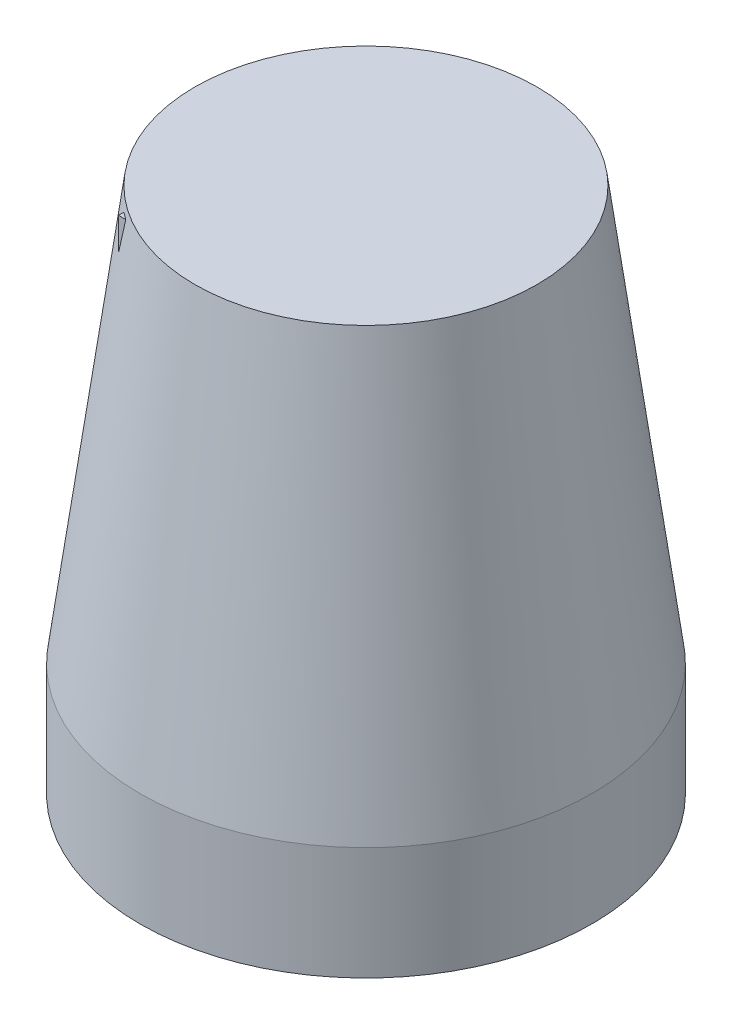
from build123d import *

# Parameters (mm, degrees)
SKETCH1_R           = 5.0038
BOSS_EXTRUDE1_DEPTH = 12.0904
SKETCH1_5_R         = 6.604
SKETCH1_6_R         = 6.604
BOSS_EXTRUDE2_DEPTH = 3.302
SKETCH2_R           = 2.9972
CUT_EXTRUDE1_DEPTH  = 11.43
SKETCH3_R           = 5.2705
CUT_EXTRUDE2_DEPTH  = 2.9464
SKETCH4_W           = 1.623389838
SKETCH4_H           = 6.759688833
BOSS_EXTRUDE3_DEPTH = 12.192


with BuildPart() as part:
    # Sketch1 → Boss-Extrude1 (new body)
    with BuildSketch(Plane(origin=(0, 0, 0), x_dir=(1, 0, 0), z_dir=(0, 1, 0))):
        Circle(SKETCH1_R)
    extrude(amount=BOSS_EXTRUDE1_DEPTH)

    # Sketch1<5> → section 0 of loft1
    with BuildSketch(Plane(origin=(0, 0, 0), x_dir=(1, 0, 0), z_dir=(0, 1, 0)), mode=Mode.PRIVATE) as loft1_s0:
        Circle(SKETCH1_5_R)
    # loft up to a face of the part (loft1)
    loft([loft1_s0.sketch, Face(Wire([part.edges().sort_by_distance((-3.425336809, 12.0904, -3.647613218))[0]]))])

    # Sketch1<6> → Boss-Extrude2 (add)
    with BuildSketch(Plane(origin=(0, 0, 0), x_dir=(1, 0, 0), z_dir=(0, 1, 0))):
        Circle(SKETCH1_6_R)
    extrude(amount=-BOSS_EXTRUDE2_DEPTH)

    # Sketch2 → Cut-Extrude1 (cut)
    with BuildSketch(Plane.XZ.offset(3.302)):
        Circle(SKETCH2_R)
    extrude(amount=-CUT_EXTRUDE1_DEPTH, mode=Mode.SUBTRACT)

    # Sketch3 → Cut-Extrude2 (cut)
    with BuildSketch(Plane.XZ.offset(3.302)):
        Circle(SKETCH3_R)
    extrude(amount=-CUT_EXTRUDE2_DEPTH, mode=Mode.SUBTRACT)

    # Sketch4 → Boss-Extrude3 (add)
    with BuildSketch(Plane.XZ.offset(0.3556)):
        with Locations((-2.310294919, 0.731856075)):
            Rectangle(SKETCH4_W, SKETCH4_H)
    extrude(amount=-BOSS_EXTRUDE3_DEPTH)


solid = part.part
